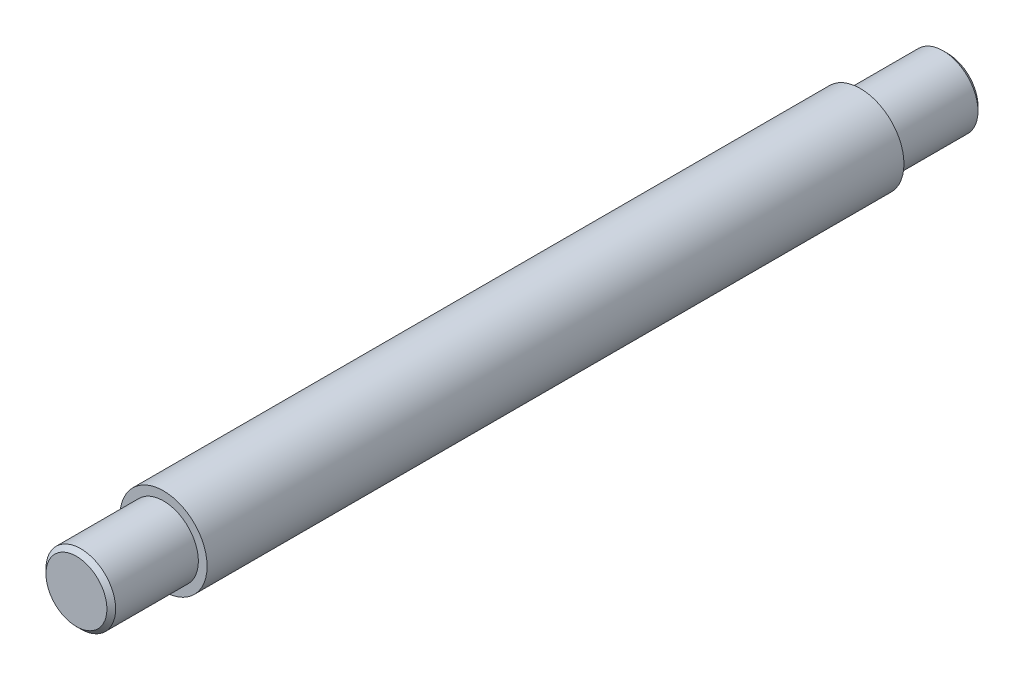
from build123d import *

# Parameters (mm, degrees)
ESQUISSE1_R        = 4
BOSS_EXTRU_1_DEPTH = 10
ESQUISSE2_R        = 5
BOSS_EXTRU_2_DEPTH = 80
ESQUISSE3_R        = 4
BOSS_EXTRU_3_DEPTH = 10
CHANFREIN1_SIZE    = 0.5


with BuildPart() as part:
    # Esquisse1 → Boss.-Extru.1 (new body)
    with BuildSketch(Plane.XY):
        Circle(ESQUISSE1_R)
    extrude(amount=BOSS_EXTRU_1_DEPTH)

    # Esquisse2 → Boss.-Extru.2 (add)
    with BuildSketch(Plane.XY.offset(10)):
        Circle(ESQUISSE2_R)
    extrude(amount=BOSS_EXTRU_2_DEPTH)

    # Esquisse3 → Boss.-Extru.3 (add)
    with BuildSketch(Plane.XY.offset(90)):
        Circle(ESQUISSE3_R)
    extrude(amount=BOSS_EXTRU_3_DEPTH)

    # Chanfrein1
    chanfrein1_edges = [part.edges().sort_by_distance(p)[0] for p in [
        (-4, 0, 100),
        (-4, 0, 0),
    ]]
    chamfer(chanfrein1_edges, length=CHANFREIN1_SIZE)


solid = part.part
